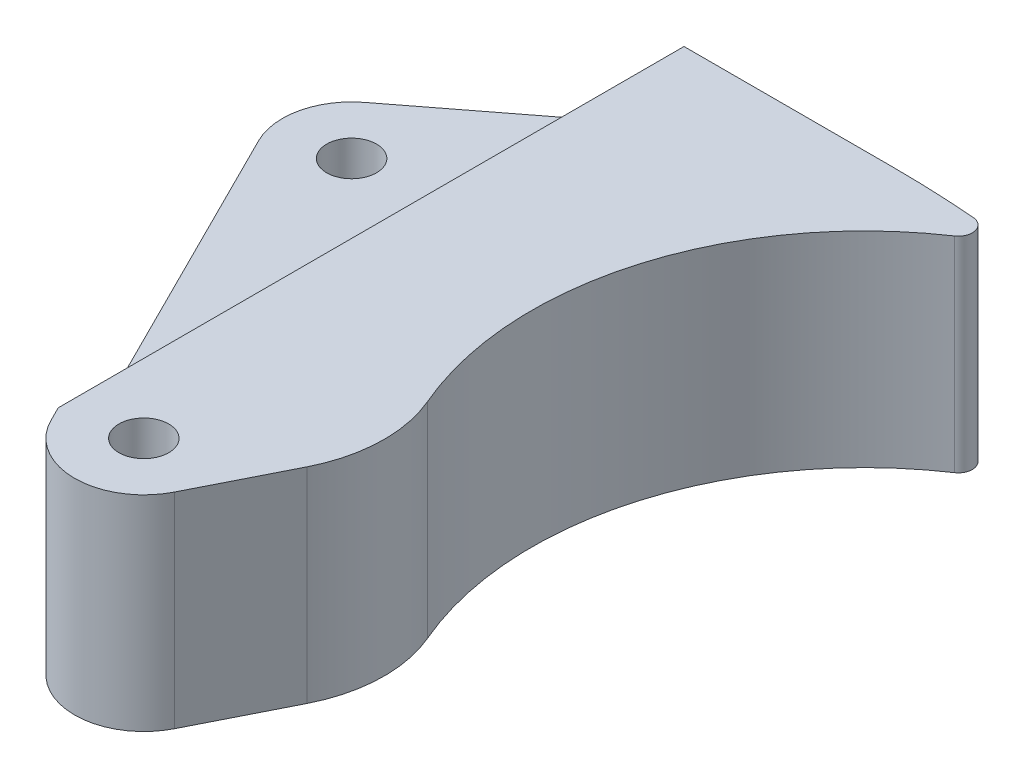
from build123d import *

# Parameters (mm, degrees)
SKETCH1_R           = 2.286
BOSS_EXTRUDE1_DEPTH = 76.2
SKETCH2_W           = 19.05
SKETCH2_H           = 63.5
SKETCH2_H_2         = 6.35
CUT_EXTRUDE1_DEPTH  = 102.60793719
SKETCH3_W           = 25.4
SKETCH3_H           = 6.858
CUT_EXTRUDE2_DEPTH  = 100.367382835
FILLET1_R           = 1.27
FILLET2_R           = 12.7
SKETCH4_W           = 59.009552573
SKETCH4_H           = 74.343024825
CUT_EXTRUDE3_DEPTH  = 85.041380514


with BuildPart() as part:
    # Sketch1 → Boss-Extrude1 (new body)
    with BuildSketch(Plane(origin=(0, 0, 0), x_dir=(1, 0, 0), z_dir=(0, 1, 0))):
        with BuildLine():
            Line((-5.679612663, -2.839806331), (-24.729612663, 35.260193669))
            ThreePointArc((-24.729612663, 35.260193669), (-25.238895582, 39.521292183), (-22.921549668, 43.133249763))
            Line((-22.921549668, 43.133249763), (-6.35, 55.88))
            Line((-6.35, 55.88), (12.7, 55.88))
            ThreePointArc((12.7, 55.88), (18.555327731, 55.700289554), (24.388613689, 55.161834718))
            ThreePointArc((24.388613689, 55.161834718), (8.638623245, 35.753941369), (12.7, 11.091546065))
            Line((12.7, 11.091546065), (5.670682494, -2.857596902))
            ThreePointArc((5.670682494, -2.857596902), (-0.009953044, -6.3499922), (-5.679612663, -2.839806331))
        make_face()
        with Locations(Location((0, 0, 0), (0, 0, 90))):
            Circle(SKETCH1_R, mode=Mode.SUBTRACT)
        with Locations(Location((-19.05, 38.1, 0), (0, 0, 90))):
            Circle(SKETCH1_R, mode=Mode.SUBTRACT)
    extrude(amount=BOSS_EXTRUDE1_DEPTH)

    # Sketch2 → Cut-Extrude1 (cut, through all)
    with BuildSketch(Plane(origin=(0, 0, -55.88), x_dir=(-1, 0, 0), z_dir=(0, 0, -1))):
        with Locations((15.875, 31.75)):
            Rectangle(SKETCH2_W, SKETCH2_H)
        with Locations((15.875, 73.025)):
            Rectangle(SKETCH2_W, SKETCH2_H_2)
    extrude(amount=-CUT_EXTRUDE1_DEPTH, mode=Mode.SUBTRACT)

    # Sketch3 → Cut-Extrude2 (cut, through all)
    with BuildSketch(Plane.ZY.offset(6.35)):
        with Locations((-6.35, 53.975)):
            Rectangle(SKETCH3_W, SKETCH3_H)
    extrude(amount=-CUT_EXTRUDE2_DEPTH, mode=Mode.SUBTRACT)

    # Fillet1
    fillet1_edges = [part.edges().sort_by_distance(p)[0] for p in [
        (24.388613689, 38.1, -55.161834718),
    ]]
    fillet(fillet1_edges, radius=FILLET1_R)

    # Fillet2
    fillet2_edges = [part.edges().sort_by_distance(p)[0] for p in [
        (12.7, 66.802, -11.091546065),
        (12.7, 25.273, -11.091546065),
    ]]
    fillet(fillet2_edges, radius=FILLET2_R)

    # Sketch4 → Cut-Extrude3 (cut, through all)
    with BuildSketch(Plane.XZ.offset(-57.404)):
        with Locations((-1.749174137, -25.683599477)):
            Rectangle(SKETCH4_W, SKETCH4_H)
    extrude(amount=CUT_EXTRUDE3_DEPTH, mode=Mode.SUBTRACT)


solid = part.part
